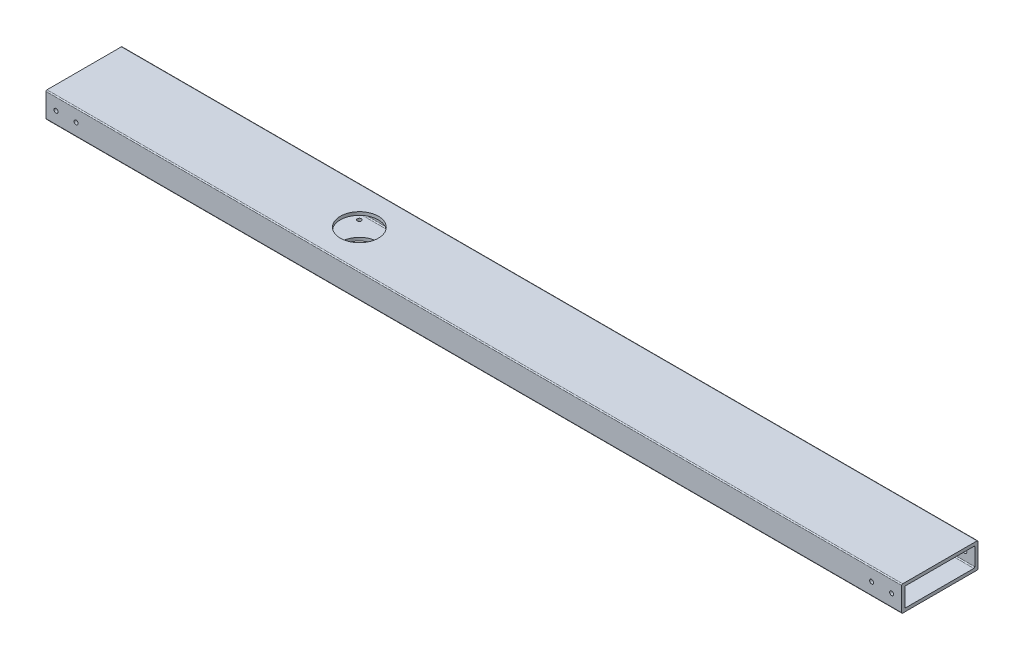
from build123d import *

# Parameters (mm, degrees)
SKETCH1_W                 = 76.2
SKETCH1_H                 = 25.4
SKETCH1_W_2               = 69.85
SKETCH1_H_2               = 19.05
BOSS_EXTRUDE1_DEPTH       = 427.2
FILLET1_R                 = 1
SKETCH2_R                 = 19
CUT_EXTRUDE1_DEPTH        = 430.647076099
F_4_0MM_DOWEL_HOLE1_D     = 4
F_4_0MM_DOWEL_HOLE2_D     = 4
F_4_0MM_DOWEL_HOLE2_DEPTH = 3.175


with BuildPart() as part:
    # Sketch1 → Boss-Extrude1 (new, symmetric)
    with BuildSketch(Plane(origin=(0, 0, 0), x_dir=(0, 0, -1), z_dir=(1, 0, 0))):
        Rectangle(SKETCH1_W, SKETCH1_H)
        Rectangle(SKETCH1_W_2, SKETCH1_H_2, mode=Mode.SUBTRACT)
    extrude(amount=BOSS_EXTRUDE1_DEPTH, both=True)

    # Fillet1
    fillet1_edges = [part.edges().sort_by_distance(p)[0] for p in [
        (0, 9.525, 34.925),
        (0, -9.525, 34.925),
        (0, -9.525, -34.925),
        (0, 9.525, -34.925),
        (0, 12.7, 38.1),
        (0, 12.7, -38.1),
        (0, -12.7, -38.1),
        (0, -12.7, 38.1),
    ]]
    fillet(fillet1_edges, radius=FILLET1_R)

    # Sketch2 → Cut-Extrude1 (cut, through all)
    with BuildSketch(Plane(origin=(0, 12.7, 0), x_dir=(1, 0, 0), z_dir=(0, 1, 0))):
        with Locations(Location((-152.4, 0, 0), (0, 0, 270))):
            Circle(SKETCH2_R)
    extrude(amount=-CUT_EXTRUDE1_DEPTH, mode=Mode.SUBTRACT)

    # Ø4.0mm Dowel Hole1 (through all)
    with Locations(Plane.XY.offset(38.1)):
        with Locations((-417.2, 0), (-397.2, 0)):
            f_4_0mm_dowel_hole1 = Hole(F_4_0MM_DOWEL_HOLE1_D / 2)

    # Mirror1: Ø4.0mm Dowel Hole1 across plane
    add(f_4_0mm_dowel_hole1.mirror(Plane(origin=(0, 0, 0), x_dir=(0, 0, 1), z_dir=(1, 0, 0))), mode=Mode.SUBTRACT)

    # Ø4.0mm Dowel Hole2
    with Locations(Plane(origin=(0, -12.7, 0), x_dir=(-1, 0, 0), z_dir=(0, -1, 0))):
        with Locations((180.96711396, -28.56711396), (180.96711396, 28.56711396), (123.83288604, 28.56711396), (123.83288604, -28.56711396)):
            Hole(F_4_0MM_DOWEL_HOLE2_D / 2, depth=F_4_0MM_DOWEL_HOLE2_DEPTH)


solid = part.part
